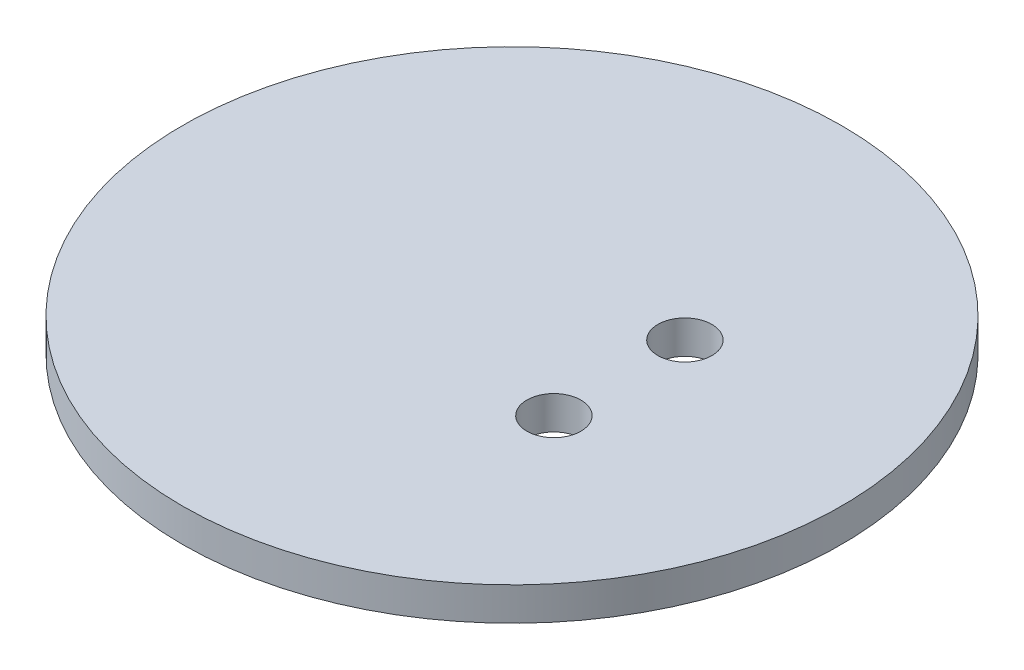
from build123d import *

# Parameters (mm, degrees)
SKETCH1_R           = 7.925
BOSS_EXTRUDE1_DEPTH = 0.8
SKETCH3_R           = 0.65
CUT_EXTRUDE1_DEPTH  = 0.9


with BuildPart() as part:
    # Sketch1 → Boss-Extrude1 (new body)
    with BuildSketch(Plane(origin=(0, 0, 0), x_dir=(1, 0, 0), z_dir=(0, 1, 0))):
        with Locations(Location((0, 0, 0), (0, 0, 270))):
            Circle(SKETCH1_R)
    extrude(amount=BOSS_EXTRUDE1_DEPTH)

    # Sketch3 → Cut-Extrude1 (cut)
    with BuildSketch(Plane(origin=(0, 0.8, 0), x_dir=(1, 0, 0), z_dir=(0, 1, 0))):
        with Locations(Location((2.582634314, 1.575, 0), (0, 0, 270))):
            Circle(SKETCH3_R)
        with Locations(Location((2.582634314, -1.575, 0), (0, 0, 270))):
            Circle(SKETCH3_R)
    extrude(amount=-CUT_EXTRUDE1_DEPTH, mode=Mode.SUBTRACT)


solid = part.part
